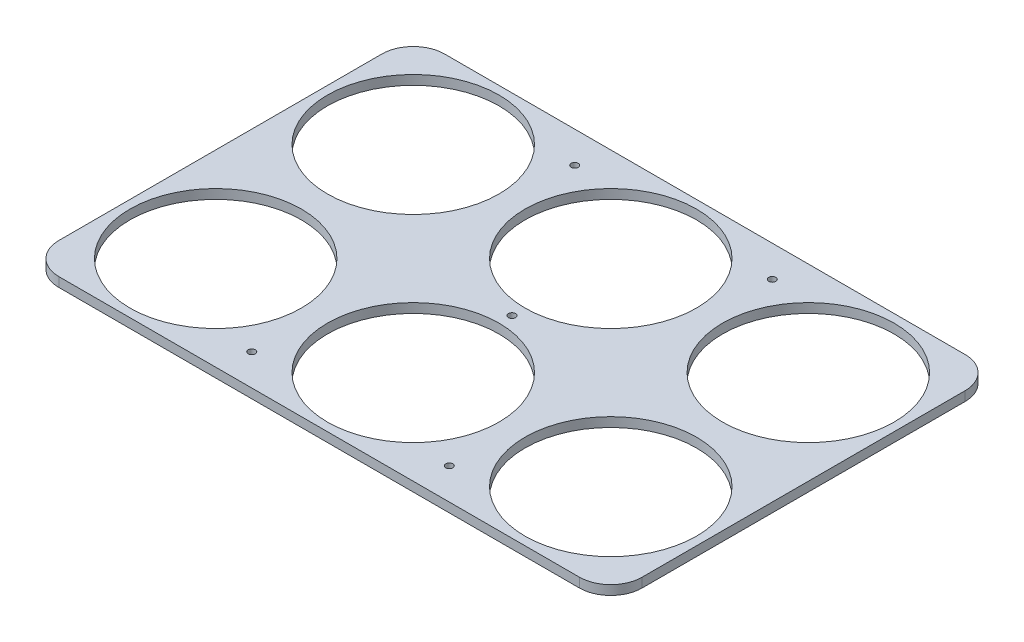
from build123d import *

# Parameters (mm, degrees)
SKETCH1_W                 = 186
SKETCH1_H                 = 123
SKETCH1_R                 = 27.35
BOSS_EXTRUDE1_DEPTH       = 3
FILLET1_R                 = 10
TAP_DRILL_FOR_4_40_TAP1_D = 2.2606


with BuildPart() as part:
    # Sketch1 → Boss-Extrude1 (new body)
    with BuildSketch(Plane(origin=(0, 0, 0), x_dir=(1, 0, 0), z_dir=(0, 1, 0))):
        Rectangle(SKETCH1_W, SKETCH1_H)
        with Locations(Location((-63, 31.5, 0), (0, 0, 270))):
            Circle(SKETCH1_R, mode=Mode.SUBTRACT)
        with Locations(Location((0, 31.5, 0), (0, 0, 270))):
            Circle(SKETCH1_R, mode=Mode.SUBTRACT)
        with Locations(Location((63, 31.5, 0), (0, 0, 270))):
            Circle(SKETCH1_R, mode=Mode.SUBTRACT)
        with Locations(Location((0, -31.5, 0), (0, 0, 270))):
            Circle(SKETCH1_R, mode=Mode.SUBTRACT)
        with Locations(Location((63, -31.5, 0), (0, 0, 270))):
            Circle(SKETCH1_R, mode=Mode.SUBTRACT)
        with Locations(Location((-63, -31.5, 0), (0, 0, 270))):
            Circle(SKETCH1_R, mode=Mode.SUBTRACT)
    extrude(amount=BOSS_EXTRUDE1_DEPTH)

    # Fillet1
    fillet1_edges = [part.edges().sort_by_distance(p)[0] for p in [
        (-93, 1.5, -61.5),
        (93, 1.5, -61.5),
        (93, 1.5, 61.5),
        (-93, 1.5, 61.5),
    ]]
    fillet(fillet1_edges, radius=FILLET1_R)

    # Tap Drill for #4-40 Tap1 (through all)
    with Locations(Plane(origin=(0, 3, 0), x_dir=(1, 0, 0), z_dir=(0, 1, 0))):
        with Locations((0, 0), (31.5, 51.5), (-31.5, 51.5), (-31.5, -51.5), (31.5, -51.5)):
            Hole(TAP_DRILL_FOR_4_40_TAP1_D / 2)


solid = part.part
